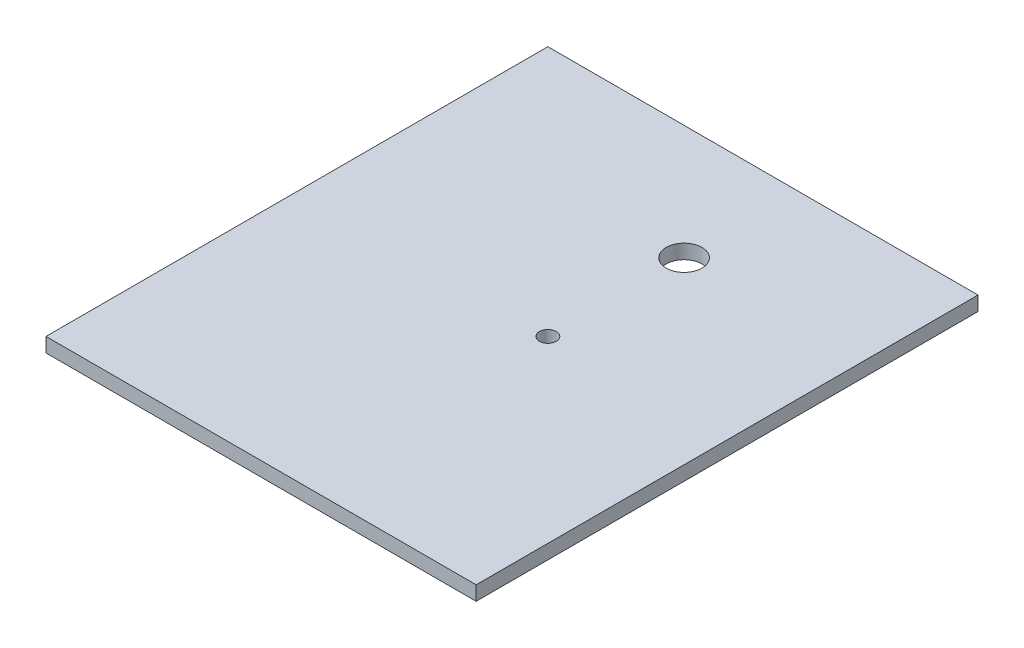
from build123d import *

# Parameters (mm, degrees)
SKETCH1_W           = 152.4
SKETCH1_H           = 177.8
SKETCH1_R           = 2.9972
SKETCH1_R_2         = 6.35
BOSS_EXTRUDE1_DEPTH = 5.08


with BuildPart() as part:
    # Sketch1 → Boss-Extrude1 (new body)
    with BuildSketch(Plane(origin=(0, 0, 0), x_dir=(1, 0, 0), z_dir=(0, 1, 0))):
        with Locations((-12.7, 0)):
            Rectangle(SKETCH1_W, SKETCH1_H)
        with Locations(Location((0, 0, 0), (0, 0, 270))):
            Circle(SKETCH1_R, mode=Mode.SUBTRACT)
        with Locations(Location((0, 48.26, 0), (0, 0, 270))):
            Circle(SKETCH1_R_2, mode=Mode.SUBTRACT)
    extrude(amount=BOSS_EXTRUDE1_DEPTH)


solid = part.part
